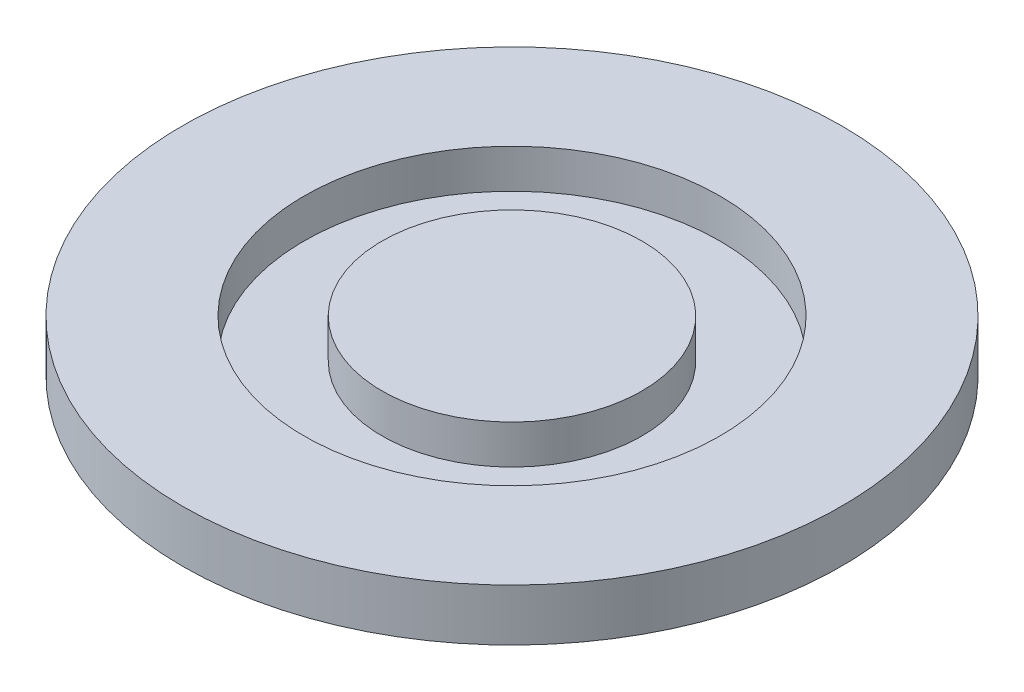
from build123d import *


with BuildPart() as part:
    # Sketch1 → Revolve1 (revolve)
    with BuildSketch(Plane.XY, mode=Mode.PRIVATE) as revolve1_sk:
        Polygon((0, 0), (0, 12.7), (31.75, 12.7), (31.75, 3.175), (50.8, 3.175), (50.8, 12.7), (80.512002317, 12.7), (80.512002317, 0), align=None)
    revolve(revolve1_sk.sketch.rotate(Axis((0, 0, 0), (0, 1, 0)), 90), axis=Axis((0, 0, 0), (0, 1, 0)))


solid = part.part
